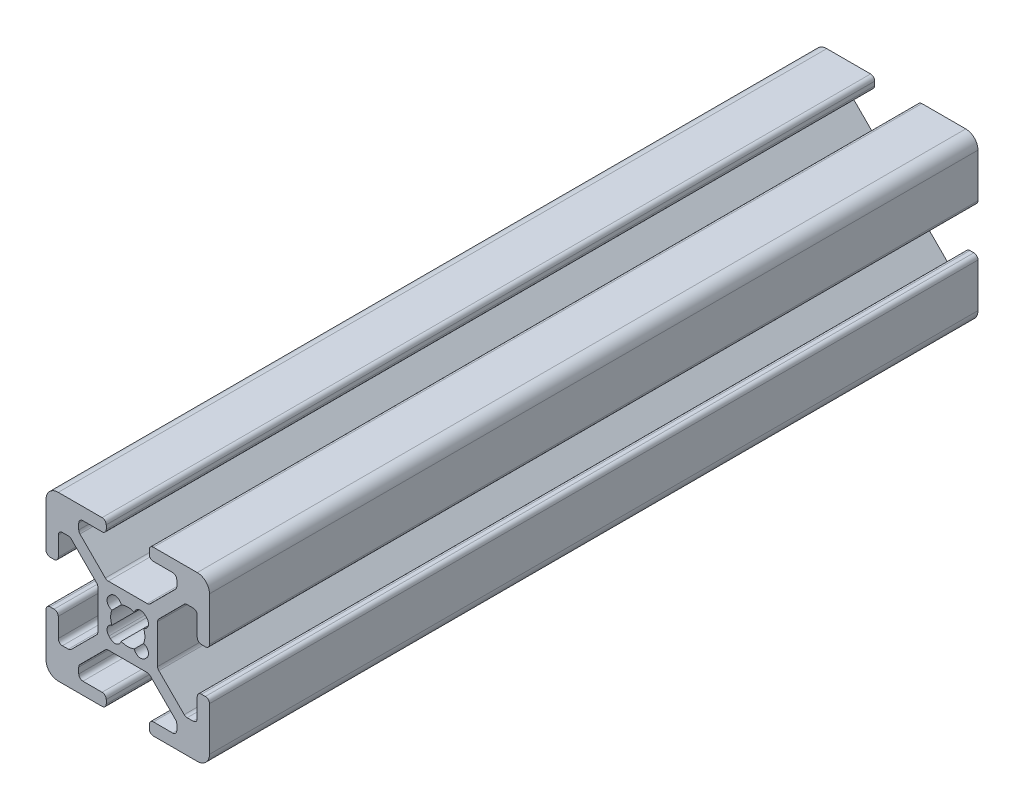
from build123d import *

# Parameters (mm, degrees)
BOSS_EXTRUDE1_DEPTH = 94


with BuildPart() as part:
    # Sketch2 → Boss-Extrude1 (new body)
    with BuildSketch(Plane.XY):
        with BuildLine():
            Line((-10, -3.138), (-10, -8.5))
            ThreePointArc((-10, -8.5), (-9.560660172, -9.560660172), (-8.5, -10))
            Line((-8.5, -10), (-3.138, -10))
            ThreePointArc((-3.138, -10), (-2.778789755, -9.851210245), (-2.63, -9.492))
            Line((-2.63, -9.492), (-2.63, -9.008))
            ThreePointArc((-2.63, -9.008), (-2.778789755, -8.648789755), (-3.138, -8.5))
            Line((-3.138, -8.5), (-5.487, -8.5))
            ThreePointArc((-5.487, -8.5), (-5.846210245, -8.351210245), (-5.995, -7.992))
            Line((-5.995, -7.992), (-5.995, -7.266240833))
            ThreePointArc((-5.995, -7.266240833), (-5.956330803, -7.07183765), (-5.846210245, -6.907030588))
            Line((-5.846210245, -6.907030588), (-2.742969412, -3.803789755))
            ThreePointArc((-2.742969412, -3.803789755), (-2.57816235, -3.693669197), (-2.383759167, -3.655))
            Line((-2.383759167, -3.655), (2.38407951, -3.655))
            ThreePointArc((2.38407951, -3.655), (2.578482694, -3.693669197), (2.743289755, -3.803789755))
            Line((2.743289755, -3.803789755), (5.846210245, -6.906710245))
            ThreePointArc((5.846210245, -6.906710245), (5.956330803, -7.071517306), (5.995, -7.26592049))
            Line((5.995, -7.26592049), (5.995, -7.992))
            ThreePointArc((5.995, -7.992), (5.846210245, -8.351210245), (5.487, -8.5))
            Line((5.487, -8.5), (3.138, -8.5))
            ThreePointArc((3.138, -8.5), (2.778789755, -8.648789755), (2.63, -9.008))
            Line((2.63, -9.008), (2.63, -9.492))
            ThreePointArc((2.63, -9.492), (2.778789755, -9.851210245), (3.138, -10))
            Line((3.138, -10), (8.5, -10))
            ThreePointArc((8.5, -10), (9.560660172, -9.560660172), (10, -8.5))
            Line((10, -8.5), (10, -3.138))
            ThreePointArc((10, -3.138), (9.851210245, -2.778789755), (9.492, -2.63))
            Line((9.492, -2.63), (9.008, -2.63))
            ThreePointArc((9.008, -2.63), (8.648789755, -2.778789755), (8.5, -3.138))
            Line((8.5, -3.138), (8.5, -5.487))
            ThreePointArc((8.5, -5.487), (8.351210245, -5.846210245), (7.992, -5.995))
            Line((7.992, -5.995), (7.266240833, -5.995))
            ThreePointArc((7.266240833, -5.995), (7.07183765, -5.956330803), (6.907030588, -5.846210245))
            Line((6.907030588, -5.846210245), (3.803789755, -2.742969412))
            ThreePointArc((3.803789755, -2.742969412), (3.693669197, -2.57816235), (3.655, -2.383759167))
            Line((3.655, -2.383759167), (3.655, 2.38407951))
            ThreePointArc((3.655, 2.38407951), (3.693669197, 2.578482694), (3.803789755, 2.743289755))
            Line((3.803789755, 2.743289755), (6.906710245, 5.846210245))
            ThreePointArc((6.906710245, 5.846210245), (7.071517306, 5.956330803), (7.26592049, 5.995))
            Line((7.26592049, 5.995), (7.992, 5.995))
            ThreePointArc((7.992, 5.995), (8.351210245, 5.846210245), (8.5, 5.487))
            Line((8.5, 5.487), (8.5, 3.138))
            ThreePointArc((8.5, 3.138), (8.648789755, 2.778789755), (9.008, 2.63))
            Line((9.008, 2.63), (9.492, 2.63))
            ThreePointArc((9.492, 2.63), (9.851210245, 2.778789755), (10, 3.138))
            Line((10, 3.138), (10, 8.5))
            ThreePointArc((10, 8.5), (9.560660172, 9.560660172), (8.5, 10))
            Line((8.5, 10), (3.138, 10))
            ThreePointArc((3.138, 10), (2.778789755, 9.851210245), (2.63, 9.492))
            Line((2.63, 9.492), (2.63, 9.008))
            ThreePointArc((2.63, 9.008), (2.778789755, 8.648789755), (3.138, 8.5))
            Line((3.138, 8.5), (5.487, 8.5))
            ThreePointArc((5.487, 8.5), (5.846210245, 8.351210245), (5.995, 7.992))
            Line((5.995, 7.992), (5.995, 7.266240833))
            ThreePointArc((5.995, 7.266240833), (5.956330803, 7.07183765), (5.846210245, 6.907030588))
            Line((5.846210245, 6.907030588), (2.742969412, 3.803789755))
            ThreePointArc((2.742969412, 3.803789755), (2.57816235, 3.693669197), (2.383759167, 3.655))
            Line((2.383759167, 3.655), (-2.38407951, 3.655))
            ThreePointArc((-2.38407951, 3.655), (-2.578482694, 3.693669197), (-2.743289755, 3.803789755))
            Line((-2.743289755, 3.803789755), (-5.846210245, 6.906710245))
            ThreePointArc((-5.846210245, 6.906710245), (-5.956330803, 7.071517306), (-5.995, 7.26592049))
            Line((-5.995, 7.26592049), (-5.995, 7.992))
            ThreePointArc((-5.995, 7.992), (-5.846210245, 8.351210245), (-5.487, 8.5))
            Line((-5.487, 8.5), (-3.138, 8.5))
            ThreePointArc((-3.138, 8.5), (-2.778789755, 8.648789755), (-2.63, 9.008))
            Line((-2.63, 9.008), (-2.63, 9.492))
            ThreePointArc((-2.63, 9.492), (-2.778789755, 9.851210245), (-3.138, 10))
            Line((-3.138, 10), (-8.5, 10))
            ThreePointArc((-8.5, 10), (-9.560660172, 9.560660172), (-10, 8.5))
            Line((-10, 8.5), (-10, 3.138))
            ThreePointArc((-10, 3.138), (-9.851210245, 2.778789755), (-9.492, 2.63))
            Line((-9.492, 2.63), (-9.008, 2.63))
            ThreePointArc((-9.008, 2.63), (-8.648789755, 2.778789755), (-8.5, 3.138))
            Line((-8.5, 3.138), (-8.5, 5.487))
            ThreePointArc((-8.5, 5.487), (-8.351210245, 5.846210245), (-7.992, 5.995))
            Line((-7.992, 5.995), (-7.266240833, 5.995))
            ThreePointArc((-7.266240833, 5.995), (-7.07183765, 5.956330803), (-6.907030588, 5.846210245))
            Line((-6.907030588, 5.846210245), (-3.803789755, 2.742969412))
            ThreePointArc((-3.803789755, 2.742969412), (-3.693669197, 2.57816235), (-3.655, 2.383759167))
            Line((-3.655, 2.383759167), (-3.655, -2.38407951))
            ThreePointArc((-3.655, -2.38407951), (-3.693669197, -2.578482694), (-3.803789755, -2.743289755))
            Line((-3.803789755, -2.743289755), (-6.906710245, -5.846210245))
            ThreePointArc((-6.906710245, -5.846210245), (-7.071517306, -5.956330803), (-7.26592049, -5.995))
            Line((-7.26592049, -5.995), (-7.992, -5.995))
            ThreePointArc((-7.992, -5.995), (-8.351210245, -5.846210245), (-8.5, -5.487))
            Line((-8.5, -5.487), (-8.5, -3.138))
            ThreePointArc((-8.5, -3.138), (-8.648789755, -2.778789755), (-9.008, -2.63))
            Line((-9.008, -2.63), (-9.492, -2.63))
            ThreePointArc((-9.492, -2.63), (-9.851210245, -2.778789755), (-10, -3.138))
        make_face()
        with BuildLine():
            Line((-2.124493037, 2.304493037), (-2.304493037, 2.124493037))
            ThreePointArc((-2.304493037, 2.124493037), (-2.506016078, 1.35638567), (-1.935777391, 0.803729988))
            ThreePointArc((-1.935777391, 0.803729988), (-2.096, 0), (-1.935777391, -0.803729988))
            ThreePointArc((-1.935777391, -0.803729988), (-2.506016078, -1.35638567), (-2.304493037, -2.124493037))
            Line((-2.304493037, -2.124493037), (-2.124493037, -2.304493037))
            ThreePointArc((-2.124493037, -2.304493037), (-1.35638567, -2.506016078), (-0.803729988, -1.935777391))
            ThreePointArc((-0.803729988, -1.935777391), (0, -2.096), (0.803729988, -1.935777391))
            ThreePointArc((0.803729988, -1.935777391), (1.35638567, -2.506016078), (2.124493037, -2.304493037))
            Line((2.124493037, -2.304493037), (2.304493037, -2.124493037))
            ThreePointArc((2.304493037, -2.124493037), (2.506016078, -1.35638567), (1.935777391, -0.803729988))
            ThreePointArc((1.935777391, -0.803729988), (2.096, 0), (1.935777391, 0.803729988))
            ThreePointArc((1.935777391, 0.803729988), (2.506016078, 1.35638567), (2.304493037, 2.124493037))
            Line((2.304493037, 2.124493037), (2.124493037, 2.304493037))
            ThreePointArc((2.124493037, 2.304493037), (1.35638567, 2.506016078), (0.803729988, 1.935777391))
            ThreePointArc((0.803729988, 1.935777391), (0, 2.096), (-0.803729988, 1.935777391))
            ThreePointArc((-0.803729988, 1.935777391), (-1.35638567, 2.506016078), (-2.124493037, 2.304493037))
        make_face(mode=Mode.SUBTRACT)
    extrude(amount=-BOSS_EXTRUDE1_DEPTH)


solid = part.part
